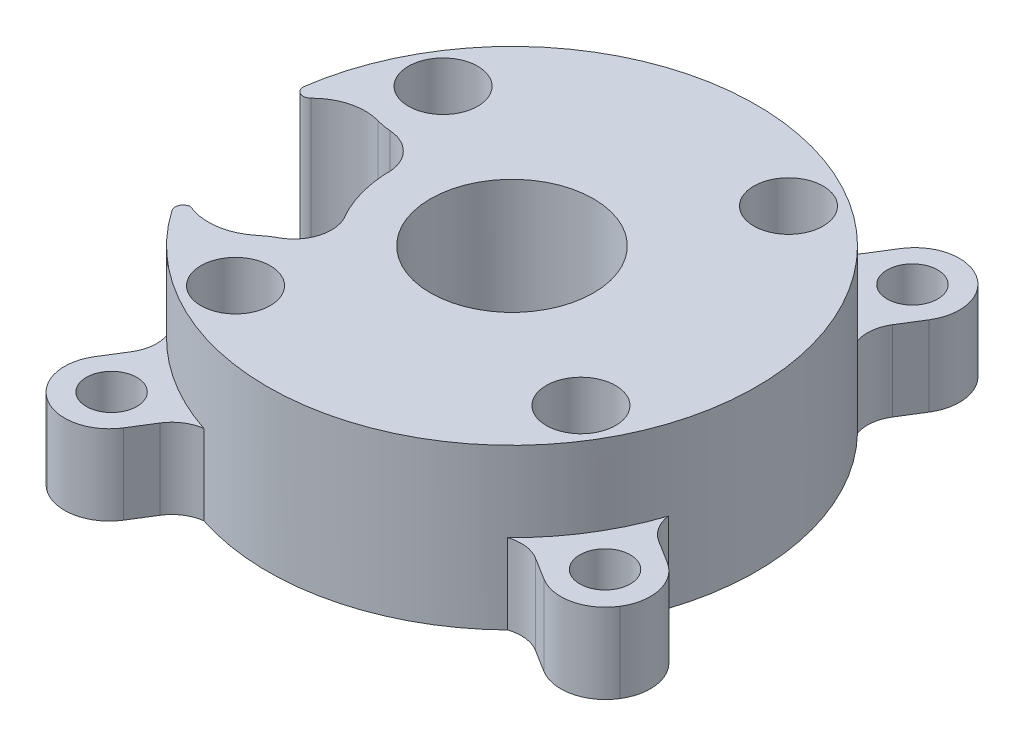
from build123d import *
from build123d.topology import SkipClean

# Parameters (mm, degrees)
BOSS_EXTRUDE2_DEPTH = 3.175
SKETCH3_R           = 9.700000031
BOSS_EXTRUDE4_DEPTH = 3.175
SKETCH4_R           = 1.0033
CUT_EXTRUDE1_DEPTH  = 3.175
SKETCH6_R           = 1.25
CUT_EXTRUDE2_DEPTH  = 18.630160878
CUT_EXTRUDE3_DEPTH  = 18.630161045
CUT_EXTRUDE4_DEPTH  = 18.630161045
SKETCH9_R           = 3.2385
CUT_EXTRUDE5_DEPTH  = 18.630161045
SKETCH11_R          = 1.377
CUT_EXTRUDE7_DEPTH  = 18.630161045


with BuildPart() as part:
    # Sketch1 → Boss-Extrude2 (new body)
    with BuildSketch(Plane(origin=(0, 0, 0), x_dir=(1, 0, 0), z_dir=(0, 1, 0))):
        with BuildLine():
            ThreePointArc((-11.359521952, 7.075729248), (-11.584059991, 5.734660127), (-10.793437735, 4.628405109))
            Line((-10.793437735, 4.628405109), (-9.903263338, 4.073924644))
            ThreePointArc((-9.903263338, 4.073924644), (-9.442762789, 3.620550105), (-9.219865441, 3.013981065))
            ThreePointArc((-9.219865441, 3.013981065), (-8.233383025, 5.128489502), (-6.770495536, 6.946250125))
            ThreePointArc((-6.770495536, 6.946250125), (-7.413198477, 6.878854591), (-8.023169667, 7.092265875))
            Line((-8.023169667, 7.092265875), (-8.913344063, 7.64674634))
            ThreePointArc((-8.913344063, 7.64674634), (-10.254863148, 7.868580207), (-11.359521952, 7.075729248))
        make_face()
        with BuildLine():
            ThreePointArc((-7.092265875, -8.023169667), (-6.878854591, -7.413198477), (-6.946250125, -6.770495536))
            ThreePointArc((-6.946250125, -6.770495536), (5.128489502, 8.233383025), (-3.013981065, -9.219865441))
            ThreePointArc((-3.013981065, -9.219865441), (-3.620550105, -9.442762789), (-4.073924644, -9.903263338))
            Line((-4.073924644, -9.903263338), (-4.628405109, -10.793437735))
            ThreePointArc((-4.628405109, -10.793437735), (-5.734660127, -11.584059991), (-7.075729248, -11.359521952))
            ThreePointArc((-7.075729248, -11.359521952), (-7.868580207, -10.254863148), (-7.64674634, -8.913344063))
            Line((-7.64674634, -8.913344063), (-7.092265875, -8.023169667))
        make_face()
        with BuildLine():
            ThreePointArc((4.073924644, 9.903263338), (3.620550105, 9.442762789), (3.013981065, 9.219865441))
            ThreePointArc((3.013981065, 9.219865441), (5.128489502, 8.233383025), (6.946250125, 6.770495536))
            ThreePointArc((6.946250125, 6.770495536), (6.878854591, 7.413198477), (7.092265875, 8.023169667))
            Line((7.092265875, 8.023169667), (7.64674634, 8.913344063))
            ThreePointArc((7.64674634, 8.913344063), (7.868580207, 10.254863148), (7.075729248, 11.359521952))
            ThreePointArc((7.075729248, 11.359521952), (5.734660127, 11.584059991), (4.628405109, 10.793437735))
            Line((4.628405109, 10.793437735), (4.073924644, 9.903263338))
        make_face()
        with BuildLine():
            ThreePointArc((9.903263338, -4.073924644), (9.442762789, -3.620550105), (9.219865441, -3.013981065))
            ThreePointArc((9.219865441, -3.013981065), (8.233383025, -5.128489502), (6.770495536, -6.946250125))
            ThreePointArc((6.770495536, -6.946250125), (7.413198477, -6.878854591), (8.023169667, -7.092265875))
            Line((8.023169667, -7.092265875), (8.913344063, -7.64674634))
            ThreePointArc((8.913344063, -7.64674634), (10.254863148, -7.868580207), (11.359521952, -7.075729248))
            ThreePointArc((11.359521952, -7.075729248), (11.584059991, -5.734660127), (10.793437735, -4.628405109))
            Line((10.793437735, -4.628405109), (9.903263338, -4.073924644))
        make_face()
    extrude(amount=BOSS_EXTRUDE2_DEPTH)

    # Sketch3 → Boss-Extrude4 (add)
    with BuildSketch(Plane(origin=(0, 3.175, 0), x_dir=(1, 0, 0), z_dir=(0, 1, 0))):
        with Locations(Location((0, 0, 0), (0, 0, 71.897391919))):
            Circle(SKETCH3_R)
    extrude(amount=BOSS_EXTRUDE4_DEPTH)

    # Sketch4 → Cut-Extrude1 (cut)
    with BuildSketch(Plane(origin=(0, 3.175, 0), x_dir=(1, 0, 0), z_dir=(0, 1, 0))):
        with Locations(Location((-6.102109375, -9.796452489, 0), (0, 0, 270))):
            Circle(SKETCH4_R)
        with Locations(Location((-9.796452489, 6.102109375, 0), (0, 0, 270))):
            Circle(SKETCH4_R)
        with Locations(Location((6.102109375, 9.796452489, 0), (0, 0, 270))):
            Circle(SKETCH4_R)
        with Locations(Location((9.796452489, -6.102109375, 0), (0, 0, 270))):
            Circle(SKETCH4_R)
    extrude(amount=-CUT_EXTRUDE1_DEPTH, mode=Mode.SUBTRACT)

    # Sketch6 → Cut-Extrude2 (cut, through all)
    with BuildSketch(Plane.XZ):
        with Locations(Location((-4.120304599, 6.857338406, 0), (0, 0, 270))):
            Circle(SKETCH6_R)
        with Locations(Location((6.857338406, 4.120304599, 0), (0, 0, 270))):
            Circle(SKETCH6_R)
        with Locations(Location((4.120304599, -6.857338406, 0), (0, 0, 270))):
            Circle(SKETCH6_R)
        with Locations(Location((-6.857338406, -4.120304599, 0), (0, 0, 270))):
            Circle(SKETCH6_R)
        with BuildLine():
            ThreePointArc((-7.740826737, 4.188918313), (-8.600917053, 2.001520862), (-8.865312738, -0.333978632))
            ThreePointArc((-8.865312738, -0.333978632), (-8.220855367, -1.436176951), (-6.960889199, -1.642699812))
            add(Edge.make_bspline(
                [(-6.960889199, -1.642699812), (-6.667021958, -1.55913113), (-6.387287356, -1.541557431)],
                knots=[0, 0, 0, 1, 1, 1], degree=2))
            ThreePointArc((-6.387287356, -1.541557431), (-5.348606232, -1.027965094), (-4.985782131, 0.07248674))
            ThreePointArc((-4.985782131, 0.07248674), (-4.766455839, 1.294643053), (-4.258288499, 2.427575545))
            ThreePointArc((-4.258288499, 2.427575545), (-4.213628063, 3.537788389), (-4.945115585, 4.374145441))
            add(Edge.make_bspline(
                [(-4.945115585, 4.374145441), (-5.082112842, 4.444222059), (-5.247145609, 4.565325221), (-5.339984058, 4.633451266), (-5.43868295, 4.713583878)],
                knots=[0, 0, 0, 0.6, 0.6, 1, 1, 1], degree=2))
            ThreePointArc((-5.43868295, 4.713583878), (-6.717452114, 5.011565124), (-7.740826737, 4.188918313))
        make_face()
    extrude(amount=-CUT_EXTRUDE2_DEPTH, mode=Mode.SUBTRACT)

    # Sketch7 → Cut-Extrude3 (cut, through all)
    with SkipClean():  # the faces are left unmerged after this step: merging them gives an invalid solid
        with BuildSketch(Plane.XZ):
            with BuildLine():
                ThreePointArc((-6.960889199, -1.642699812), (-8.884242595, -1.255389349), (-9.685199878, 0.535634133))
                ThreePointArc((-9.685199878, 0.535634133), (-9.438161419, 2.238550786), (-8.894109958, 3.871021655))
                ThreePointArc((-8.894109958, 3.871021655), (-7.375413308, 5.149500563), (-5.43868295, 4.713583878))
                ThreePointArc((-5.43868295, 4.713583878), (-6.717452114, 5.011565124), (-7.740826737, 4.188918313))
                ThreePointArc((-7.740826737, 4.188918313), (-8.600917053, 2.001520862), (-8.865312738, -0.333978632))
                ThreePointArc((-8.865312738, -0.333978632), (-8.220855367, -1.436176951), (-6.960889199, -1.642699812))
            make_face()
        extrude(amount=-CUT_EXTRUDE3_DEPTH, mode=Mode.SUBTRACT)

    # Sketch8 → Cut-Extrude4 (cut, through all)
    with SkipClean():  # the faces are left unmerged after this step: merging them gives an invalid solid
        with BuildSketch(Plane.XZ):
            with BuildLine():
                Line((-9.60430299, -1.35917794), (-10.364546908, 0.869720512))
                Line((-10.364546908, 0.869720512), (-8.848022827, 0.869720512))
                Line((-8.848022827, 0.869720512), (-9.066395788, -1.091827064))
                ThreePointArc((-9.066395788, -1.091827064), (-9.431806259, -1.031432276), (-9.60430299, -1.35917794))
            make_face()
            with BuildLine():
                Line((-8.296144244, 3.19654695), (-7.610330094, 5.047226445))
                ThreePointArc((-7.610330094, 5.047226445), (-7.963941166, 5.15736977), (-7.97087416, 5.527672722))
                Line((-7.97087416, 5.527672722), (-9.651132171, 3.877614498))
                Line((-9.651132171, 3.877614498), (-8.296144244, 3.19654695))
            make_face()
        extrude(amount=-CUT_EXTRUDE4_DEPTH, mode=Mode.SUBTRACT)

    # Sketch9 → Cut-Extrude5 (cut, through all)
    with SkipClean():  # the faces are left unmerged after this step: merging them gives an invalid solid
        with BuildSketch(Plane.XZ):
            with Locations(Location((0, 0, 0), (0, 0, 270))):
                Circle(SKETCH9_R)
        extrude(amount=-CUT_EXTRUDE5_DEPTH, mode=Mode.SUBTRACT)

    # Sketch11 → Cut-Extrude7 (cut, through all)
    with SkipClean():  # the faces are left unmerged after this step: merging them gives an invalid solid
        with BuildSketch(Plane(origin=(0, 6.35, 0), x_dir=(1, 0, 0), z_dir=(0, 1, 0))):
            with Locations(Location((-6.857338406, 4.120304599, 0), (0, 0, 270))):
                Circle(SKETCH11_R)
            with Locations(Location((4.120304599, 6.857338406, 0), (0, 0, 270))):
                Circle(SKETCH11_R)
            with Locations(Location((6.857338406, -4.120304599, 0), (0, 0, 270))):
                Circle(SKETCH11_R)
            with Locations(Location((-4.120304599, -6.857338406, 0), (0, 0, 270))):
                Circle(SKETCH11_R)
        extrude(amount=-CUT_EXTRUDE7_DEPTH, mode=Mode.SUBTRACT)


solid = part.part
